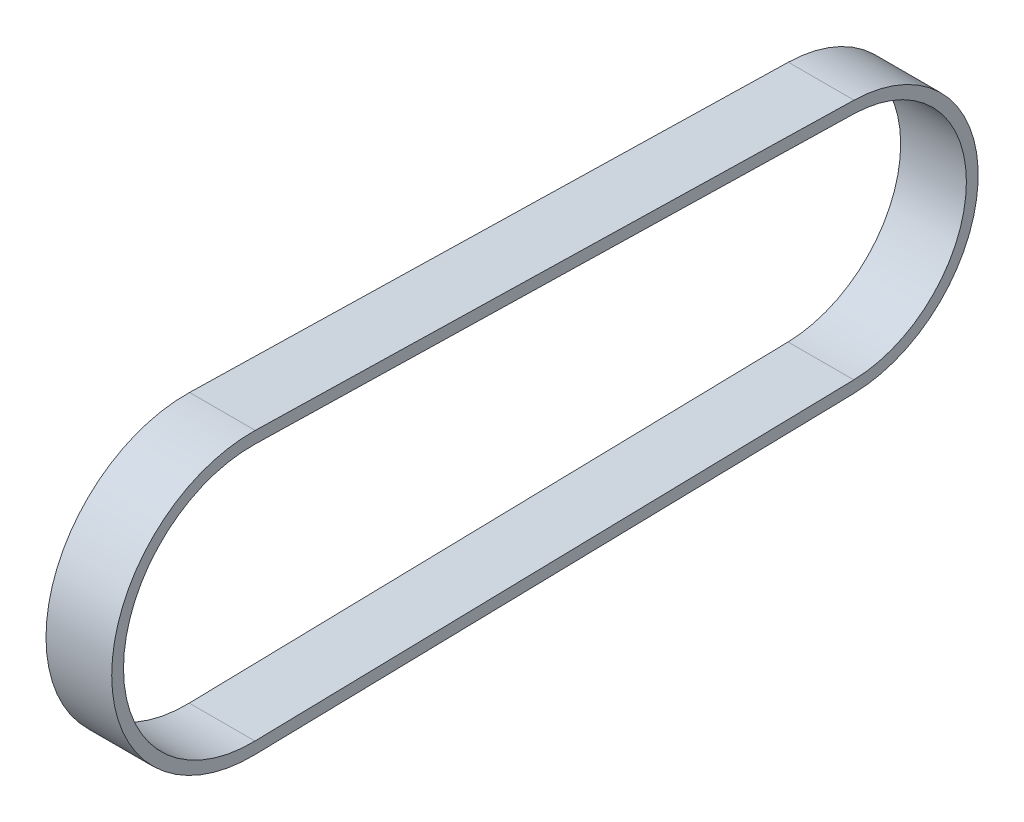
from build123d import *

# Parameters (mm, degrees)
BOSS_EXTRUDE1_DEPTH = 6.35


with BuildPart() as part:
    # Sketch1 → Boss-Extrude1 (new body)
    with BuildSketch(Plane(origin=(0, 0, 0), x_dir=(0, 0, -1), z_dir=(1, 0, 0))):
        with BuildLine():
            Line((0.303109196, 13.56272715), (58.171753639, 12.269438708))
            ThreePointArc((58.171753639, 12.269438708), (70.170050144, 0), (58.171753639, -12.269438708))
            Line((58.171753639, -12.269438708), (0.303109196, -13.56272715))
            ThreePointArc((0.303109196, -13.56272715), (-13.566113775, 0), (0.303109196, 13.56272715))
        make_face()
        with BuildLine():
            Line((0.277638048, 12.423011738), (58.146282492, 11.129723296))
            ThreePointArc((58.146282492, 11.129723296), (69.030050144, 0), (58.146282492, -11.129723296))
            Line((58.146282492, -11.129723296), (0.277638048, -12.423011738))
            ThreePointArc((0.277638048, -12.423011738), (-12.426113775, 0), (0.277638048, 12.423011738))
        make_face(mode=Mode.SUBTRACT)
    extrude(amount=BOSS_EXTRUDE1_DEPTH)


solid = part.part
